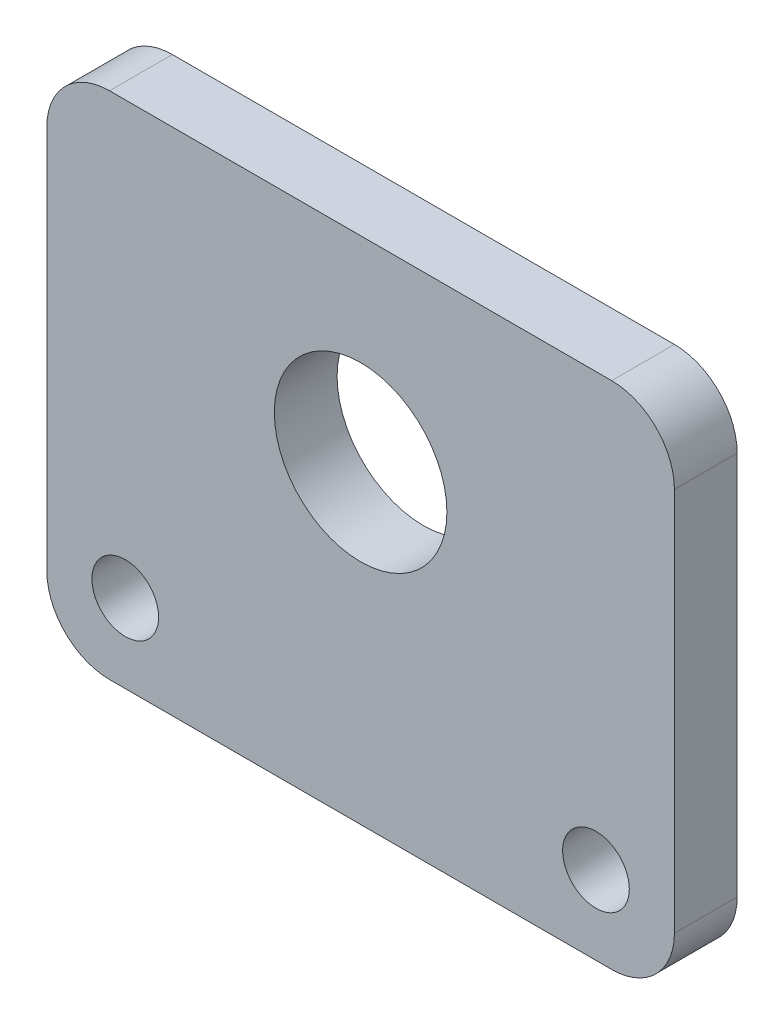
from build123d import *

# Parameters (mm, degrees)
SKIZZE1_W                       = 80
SKIZZE1_H                       = 65
SKIZZE1_R                       = 11
SKIZZE1_R_2                     = 4.25
AUFSATZ_LINEAR_AUSTRAGEN1_DEPTH = 4
VERRUNDUNG1_R                   = 8


with BuildPart() as part:
    # Skizze1 → Aufsatz-Linear austragen1 (new, symmetric)
    with BuildSketch(Plane.XY):
        with Locations((0, -7.5)):
            Rectangle(SKIZZE1_W, SKIZZE1_H)
        Circle(SKIZZE1_R, mode=Mode.SUBTRACT)
        with Locations((-30, -30)):
            Circle(SKIZZE1_R_2, mode=Mode.SUBTRACT)
        with Locations((30, -30)):
            Circle(SKIZZE1_R_2, mode=Mode.SUBTRACT)
    extrude(amount=AUFSATZ_LINEAR_AUSTRAGEN1_DEPTH, both=True)

    # Verrundung1
    verrundung1_edges = [part.edges().sort_by_distance(p)[0] for p in [
        (-40, 25, 0),
        (40, 25, 0),
        (40, -40, 0),
        (-40, -40, 0),
    ]]
    fillet(verrundung1_edges, radius=VERRUNDUNG1_R)


solid = part.part
